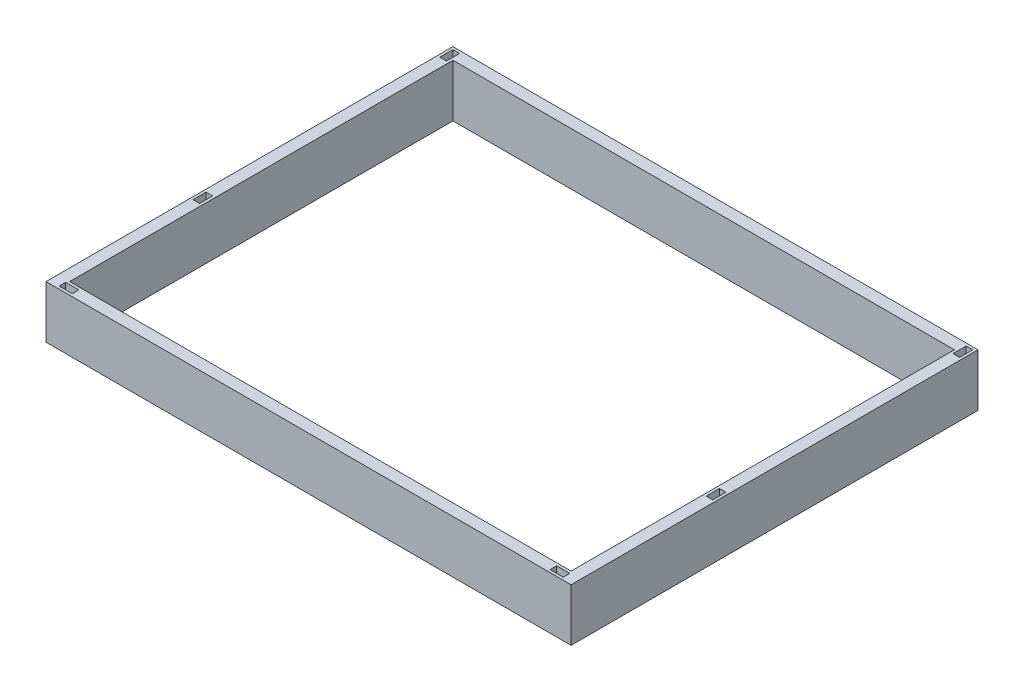
from build123d import *

# Parameters (mm, degrees)
SKETCH1_W      = 200
SKETCH1_H      = 155
SKETCH1_W_2    = 191
SKETCH1_H_2    = 146
SKETCH1_W_3    = 5
SKETCH1_H_3    = 2.5
SKETCH1_W_4    = 2.5
SKETCH1_H_4    = 5
MAINBODY_DEPTH = 20


with BuildPart() as part:
    # Sketch1 → MainBody (new body)
    with BuildSketch(Plane(origin=(0, 0, 0), x_dir=(1, 0, 0), z_dir=(0, 1, 0))):
        Rectangle(SKETCH1_W, SKETCH1_H)
        Rectangle(SKETCH1_W_2, SKETCH1_H_2, mode=Mode.SUBTRACT)
        with Locations((93.5, -75.25)):
            Rectangle(SKETCH1_W_3, SKETCH1_H_3, mode=Mode.SUBTRACT)
        with Locations((-93.5, -75.25)):
            Rectangle(SKETCH1_W_3, SKETCH1_H_3, mode=Mode.SUBTRACT)
        with Locations((97.75, -20)):
            Rectangle(SKETCH1_W_4, SKETCH1_H_4, mode=Mode.SUBTRACT)
        with Locations((97.75, 74)):
            Rectangle(SKETCH1_W_4, SKETCH1_H_4, mode=Mode.SUBTRACT)
        with Locations((-97.75, -20)):
            Rectangle(SKETCH1_W_4, SKETCH1_H_4, mode=Mode.SUBTRACT)
        with Locations((-97.75, 74)):
            Rectangle(SKETCH1_W_4, SKETCH1_H_4, mode=Mode.SUBTRACT)
    extrude(amount=MAINBODY_DEPTH)


solid = part.part
